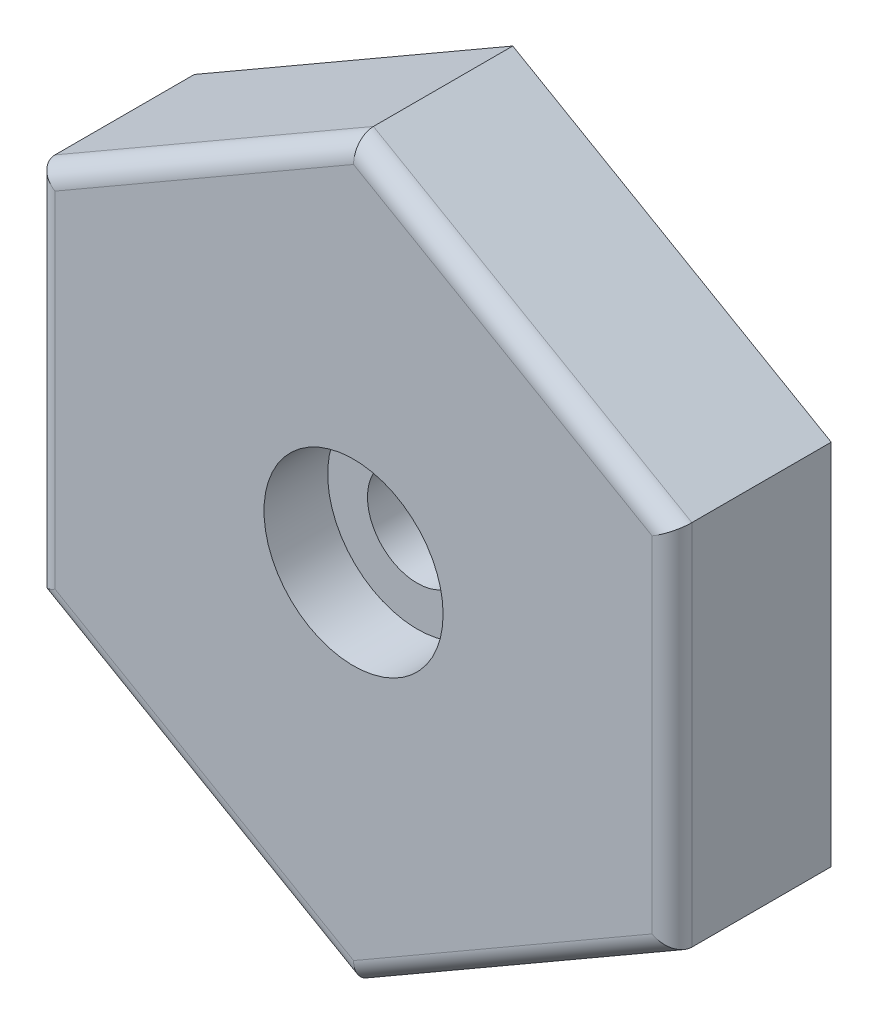
from build123d import *

# Parameters (mm, degrees)
SKIZZE1_R                       = 2.5
AUFSATZ_LINEAR_AUSTRAGEN1_DEPTH = 8
SKIZZE2_R                       = 4.5
SCHNITT_LINEAR_AUSTRAGEN1_DEPTH = 3.2
SKIZZE3_R                       = 8
SCHNITT_LINEAR_AUSTRAGEN2_DEPTH = 6
VERRUNDUNG1_R                   = 1
SKIZZE10_R                      = 8
SCHNITT_LINEAR_AUSTRAGEN3_DEPTH = 2


with BuildPart() as part:
    # Skizze1 → Aufsatz-Linear austragen1 (new body)
    with BuildSketch(Plane.XY):
        Polygon((16, 9.237604307), (0, 18.475208614), (-16, 9.237604307), (-16, -9.237604307), (0, -18.475208614), (16, -9.237604307), align=None)
        Circle(SKIZZE1_R, mode=Mode.SUBTRACT)
    extrude(amount=AUFSATZ_LINEAR_AUSTRAGEN1_DEPTH)

    # Skizze2 → Schnitt-Linear austragen1 (cut)
    with BuildSketch(Plane.XY.offset(8)):
        Circle(SKIZZE2_R)
    extrude(amount=-SCHNITT_LINEAR_AUSTRAGEN1_DEPTH, mode=Mode.SUBTRACT)

    # Skizze3 → Schnitt-Linear austragen2 (cut)
    with BuildSketch(Plane(origin=(0, 0, 0), x_dir=(-1, 0, 0), z_dir=(0, 0, -1))):
        Polygon((13.971876514, 0), (6.985938257, 12.1), (-6.985938257, 12.1), (-13.971876514, 0), (-6.985938257, -12.1), (6.985938257, -12.1), align=None)
        Circle(SKIZZE3_R, mode=Mode.SUBTRACT)
    extrude(amount=-SCHNITT_LINEAR_AUSTRAGEN2_DEPTH, mode=Mode.SUBTRACT)

    # Verrundung1
    verrundung1_edges = [part.edges().sort_by_distance(p)[0] for p in [
        (-8, 13.856406461, 8),
        (-16, 0, 8),
        (-8, -13.856406461, 8),
        (8, -13.856406461, 8),
        (16, 0, 8),
        (8, 13.856406461, 8),
    ]]
    fillet(verrundung1_edges, radius=VERRUNDUNG1_R)

    # Skizze10 → Schnitt-Linear austragen3 (cut)
    with BuildSketch(Plane(origin=(0, 0, 0), x_dir=(-1, 0, 0), z_dir=(0, 0, -1))):
        Circle(SKIZZE10_R)
    extrude(amount=-SCHNITT_LINEAR_AUSTRAGEN3_DEPTH, mode=Mode.SUBTRACT)


solid = part.part
